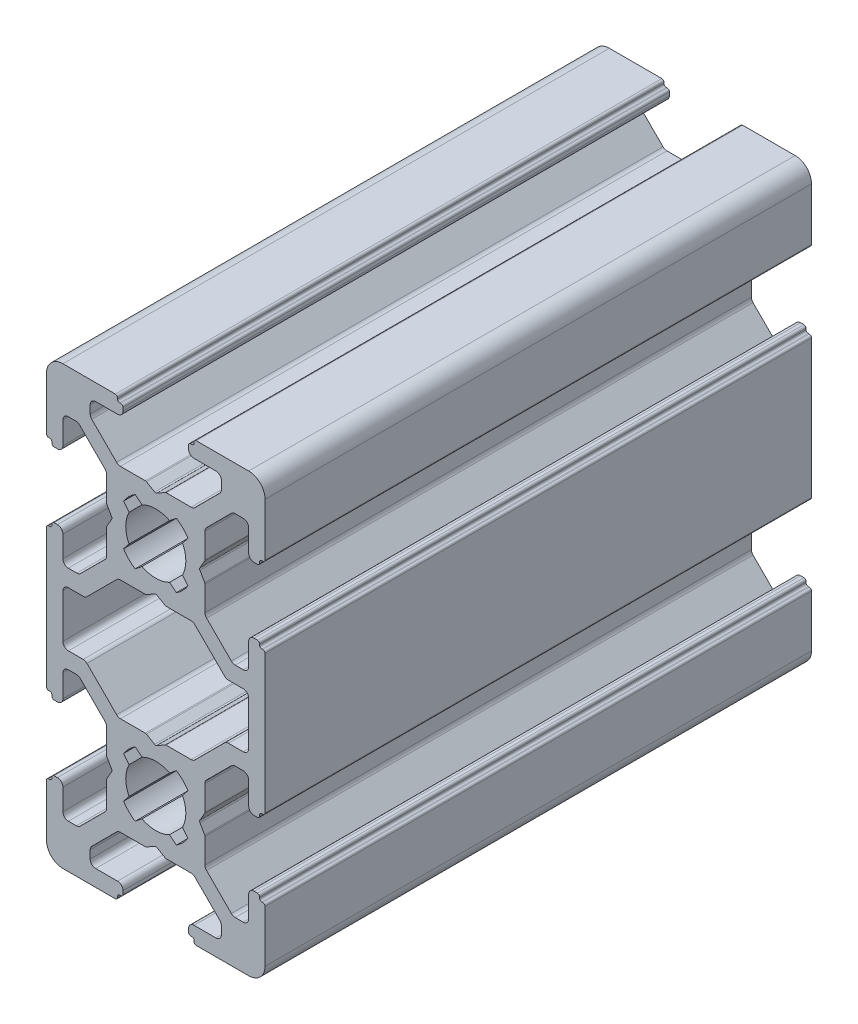
from build123d import *

# Parameters (mm, degrees)
EXTRUDE1_DEPTH = 50


with BuildPart() as part:
    # Sketch1 → Extrude1 (new body)
    with BuildSketch(Plane.XY):
        with BuildLine():
            Line((10, -3.749999824), (10, -8.500000461))
            ThreePointArc((10, -8.500000461), (9.560660307, -9.560660307), (8.500000461, -10))
            Line((8.500000461, -10), (3.699999971, -10))
            ThreePointArc((3.699999971, -10), (3.558578595, -9.941421336), (3.499999971, -9.799999942))
            Line((3.499999971, -9.799999942), (3.5, -9.699999942))
            ThreePointArc((3.5, -9.699999942), (3.441421377, -9.558578549), (3.3, -9.499999885))
            Line((3.3, -9.499999885), (3.2, -9.499999885))
            ThreePointArc((3.2, -9.499999885), (3.058578644, -9.441421241), (3, -9.299999885))
            Line((3, -9.299999885), (3, -9.000001846))
            ThreePointArc((3, -9.000001846), (3.146446609, -8.646448455), (3.5, -8.500001846))
            Line((3.5, -8.500001846), (5.499999866, -8.500001846))
            ThreePointArc((5.499999866, -8.500001846), (5.853553351, -8.353555197), (6, -8.000001712))
            Line((6, -8.000001712), (6, -7.267766328))
            ThreePointArc((6, -7.267766328), (5.961939756, -7.076424587), (5.853553353, -6.914212899))
            Line((5.853553353, -6.914212899), (3.585786596, -4.646446628))
            ThreePointArc((3.585786596, -4.646446628), (3.423574935, -4.53806028), (3.232233243, -4.500000057))
            Line((3.232233243, -4.500000057), (0.953593447, -4.500000057))
            ThreePointArc((0.953593447, -4.500000057), (0.901829637, -4.493185222), (0.853593445, -4.473205136))
            Line((0.853593445, -4.473205136), (0.100000013, -4.038117753))
            ThreePointArc((0.100000013, -4.038117753), (0, -4.011322829), (-0.100000013, -4.038117753))
            Line((-0.100000013, -4.038117753), (-0.853593445, -4.473205136))
            ThreePointArc((-0.853593445, -4.473205136), (-0.901829637, -4.493185222), (-0.953593447, -4.500000057))
            Line((-0.953593447, -4.500000057), (-3.232233243, -4.500000057))
            ThreePointArc((-3.232233243, -4.500000057), (-3.423574935, -4.53806028), (-3.585786596, -4.646446628))
            Line((-3.585786596, -4.646446628), (-5.853553353, -6.914212899))
            ThreePointArc((-5.853553353, -6.914212899), (-5.961939756, -7.076424587), (-6, -7.267766328))
            Line((-6, -7.267766328), (-6, -8.000000007))
            ThreePointArc((-6, -8.000000007), (-5.85355339, -8.353553398), (-5.499999998, -8.500000007))
            Line((-5.499999998, -8.500000007), (-3.500000002, -8.5))
            ThreePointArc((-3.500000002, -8.5), (-3.14644661, -8.646446609), (-3, -9))
            Line((-3, -9), (-3, -9.299998039))
            ThreePointArc((-3, -9.299998039), (-3.058578644, -9.441419395), (-3.2, -9.499998039))
            Line((-3.2, -9.499998039), (-3.3, -9.499998039))
            ThreePointArc((-3.3, -9.499998039), (-3.441421703, -9.558577029), (-3.5, -9.699999019))
            Line((-3.5, -9.699999019), (-3.49999951, -9.799999019))
            ThreePointArc((-3.49999951, -9.799999019), (-3.558577807, -9.94142101), (-3.69999951, -10))
            Line((-3.69999951, -10), (-8.5, -10))
            ThreePointArc((-8.5, -10), (-9.560660172, -9.560660172), (-10, -8.5))
            Line((-10, -8.5), (-10, -3.749999824))
            ThreePointArc((-10, -3.749999824), (-9.941421232, -3.608578344), (-9.799999649, -3.549999824))
            Line((-9.799999649, -3.549999824), (-9.699999649, -3.55))
            ThreePointArc((-9.699999649, -3.55), (-9.558578066, -3.49142148), (-9.499999298, -3.35))
            Line((-9.499999298, -3.35), (-9.499999298, -3.25))
            ThreePointArc((-9.499999298, -3.25), (-9.441420654, -3.108578644), (-9.299999298, -3.05))
            Line((-9.299999298, -3.05), (-8.999999788, -3.05))
            ThreePointArc((-8.999999788, -3.05), (-8.646446398, -3.196446609), (-8.499999788, -3.55))
            Line((-8.499999788, -3.55), (-8.499999788, -5.50000039))
            ThreePointArc((-8.499999788, -5.50000039), (-8.35355314, -5.853553875), (-7.999999654, -6.000000524))
            Line((-7.999999654, -6.000000524), (-7.267766643, -6.000000524))
            ThreePointArc((-7.267766643, -6.000000524), (-7.076424734, -5.96194021), (-6.914212957, -5.853553619))
            Line((-6.914212957, -5.853553619), (-4.646446283, -3.585783155))
            ThreePointArc((-4.646446283, -3.585783155), (-4.538060123, -3.423571583), (-4.499999969, -3.23223006))
            Line((-4.499999969, -3.23223006), (-4.499999969, -0.953590264))
            ThreePointArc((-4.499999969, -0.953590264), (-4.493185135, -0.901826456), (-4.473205051, -0.853590266))
            Line((-4.473205051, -0.853590266), (-4.038119483, -0.099999935))
            ThreePointArc((-4.038119483, -0.099999935), (-4.011324562, 7.7e-08), (-4.038119486, 0.100000089))
            Line((-4.038119486, 0.100000089), (-4.473205047, 0.853590344))
            ThreePointArc((-4.473205047, 0.853590344), (-4.493185134, 0.901826537), (-4.499999969, 0.953590348))
            Line((-4.499999969, 0.953590348), (-4.499999969, 3.232230144))
            ThreePointArc((-4.499999969, 3.232230144), (-4.538060128, 3.423571679), (-4.6464463, 3.585783257))
            Line((-4.6464463, 3.585783257), (-6.914212063, 5.853552589))
            ThreePointArc((-6.914212063, 5.853552589), (-7.076423834, 5.961939167), (-7.267765732, 5.999999476))
            Line((-7.267765732, 5.999999476), (-8.000000569, 5.999999476))
            ThreePointArc((-8.000000569, 5.999999476), (-8.35355396, 5.853552867), (-8.500000569, 5.499999476))
            Line((-8.500000569, 5.499999476), (-8.500000569, 3.45))
            ThreePointArc((-8.500000569, 3.45), (-8.646447179, 3.096446609), (-9.000000569, 2.95))
            Line((-9.000000569, 2.95), (-9.300000079, 2.95))
            ThreePointArc((-9.300000079, 2.95), (-9.441421491, 3.008578699), (-9.500000079, 3.150000158))
            Line((-9.500000079, 3.150000158), (-9.5, 3.250000158))
            ThreePointArc((-9.5, 3.250000158), (-9.558578588, 3.391421616), (-9.7, 3.450000315))
            Line((-9.7, 3.450000315), (-9.8, 3.450000315))
            ThreePointArc((-9.8, 3.450000315), (-9.941421356, 3.508578959), (-10, 3.650000315))
            Line((-10, 3.650000315), (-10, 9.999999757))
            Line((-10, 9.999999757), (-10, 16.3))
            ThreePointArc((-10, 16.3), (-9.941421356, 16.441421356), (-9.8, 16.5))
            Line((-9.8, 16.5), (-9.7, 16.5))
            ThreePointArc((-9.7, 16.5), (-9.558578644, 16.558578644), (-9.5, 16.7))
            Line((-9.5, 16.7), (-9.5, 16.8))
            ThreePointArc((-9.5, 16.8), (-9.441421356, 16.941421356), (-9.3, 17))
            Line((-9.3, 17), (-9.00000049, 17))
            ThreePointArc((-9.00000049, 17), (-8.6464471, 16.853553391), (-8.50000049, 16.5))
            Line((-8.50000049, 16.5), (-8.50000049, 14.55))
            ThreePointArc((-8.50000049, 14.55), (-8.353553881, 14.196446609), (-8.00000049, 14.05))
            Line((-8.00000049, 14.05), (-7.217766334, 14.05))
            ThreePointArc((-7.217766334, 14.05), (-7.026424436, 14.088060309), (-6.864212665, 14.196446888))
            Line((-6.864212665, 14.196446888), (-4.6464463, 16.414216743))
            ThreePointArc((-4.6464463, 16.414216743), (-4.538060128, 16.576428321), (-4.499999969, 16.767769856))
            Line((-4.499999969, 16.767769856), (-4.499999969, 19.046409652))
            ThreePointArc((-4.499999969, 19.046409652), (-4.493185134, 19.098173463), (-4.473205047, 19.146409656))
            Line((-4.473205047, 19.146409656), (-4.038119486, 19.899999911))
            ThreePointArc((-4.038119486, 19.899999911), (-4.011324562, 19.999999923), (-4.038119483, 20.099999935))
            Line((-4.038119483, 20.099999935), (-4.473205051, 20.853590266))
            ThreePointArc((-4.473205051, 20.853590266), (-4.493185135, 20.901826456), (-4.499999969, 20.953590264))
            Line((-4.499999969, 20.953590264), (-4.499999969, 23.23223006))
            ThreePointArc((-4.499999969, 23.23223006), (-4.538060123, 23.423571583), (-4.646446283, 23.585783155))
            Line((-4.646446283, 23.585783155), (-6.96421235, 25.903553095))
            ThreePointArc((-6.96421235, 25.903553095), (-7.126424126, 26.011939686), (-7.317766036, 26.05))
            Line((-7.317766036, 26.05), (-7.999999654, 26.05))
            ThreePointArc((-7.999999654, 26.05), (-8.35355314, 25.903553351), (-8.499999788, 25.549999866))
            Line((-8.499999788, 25.549999866), (-8.499999788, 23.5))
            ThreePointArc((-8.499999788, 23.5), (-8.646446398, 23.146446609), (-8.999999788, 23))
            Line((-8.999999788, 23), (-9.299999298, 23))
            ThreePointArc((-9.299999298, 23), (-9.441420654, 23.058578644), (-9.499999298, 23.2))
            Line((-9.499999298, 23.2), (-9.499999298, 23.3))
            ThreePointArc((-9.499999298, 23.3), (-9.558578066, 23.44142148), (-9.699999649, 23.5))
            Line((-9.699999649, 23.5), (-9.799999649, 23.499999824))
            ThreePointArc((-9.799999649, 23.499999824), (-9.941421232, 23.558578344), (-10, 23.699999824))
            Line((-10, 23.699999824), (-10, 28.5))
            ThreePointArc((-10, 28.5), (-9.560660172, 29.560660172), (-8.5, 30))
            Line((-8.5, 30), (-3.699999511, 30))
            ThreePointArc((-3.699999511, 30), (-3.55857781, 29.941421011), (-3.499999511, 29.799999023))
            Line((-3.499999511, 29.799999023), (-3.5, 29.699999023))
            ThreePointArc((-3.5, 29.699999023), (-3.441421702, 29.558577035), (-3.3, 29.499998046))
            Line((-3.3, 29.499998046), (-3.2, 29.499998046))
            ThreePointArc((-3.2, 29.499998046), (-3.058578644, 29.441419402), (-3, 29.299998046))
            Line((-3, 29.299998046), (-3, 29.000000007))
            ThreePointArc((-3, 29.000000007), (-3.146446609, 28.646446616), (-3.5, 28.500000007))
            Line((-3.5, 28.500000007), (-5.5, 28.500000007))
            ThreePointArc((-5.5, 28.500000007), (-5.853553391, 28.353553397), (-6, 28.000000007))
            Line((-6, 28.000000007), (-6, 27.267766328))
            ThreePointArc((-6, 27.267766328), (-5.961940442, 27.076426242), (-5.853555886, 26.914215433))
            Line((-5.853555886, 26.914215433), (-3.585869751, 24.646497282))
            ThreePointArc((-3.585869751, 24.646497282), (-3.423657211, 24.538109086), (-3.232313865, 24.500048177))
            Line((-3.232313865, 24.500048177), (-0.953674069, 24.500048177))
            ThreePointArc((-0.953674069, 24.500048177), (-0.901910257, 24.493233342), (-0.853674064, 24.473253255))
            Line((-0.853674064, 24.473253255), (-0.100000047, 24.038119334))
            ThreePointArc((-0.100000047, 24.038119334), (-3.5e-08, 24.011324409), (0.099999978, 24.03811933))
            Line((0.099999978, 24.03811933), (0.853674071, 24.473253259))
            ThreePointArc((0.853674071, 24.473253259), (0.901910261, 24.493233342), (0.953674069, 24.500048177))
            Line((0.953674069, 24.500048177), (3.232313865, 24.500048177))
            ThreePointArc((3.232313865, 24.500048177), (3.423657211, 24.538109086), (3.585869751, 24.646497282))
            Line((3.585869751, 24.646497282), (5.853555886, 26.914215433))
            ThreePointArc((5.853555886, 26.914215433), (5.961940442, 27.076426242), (6, 27.267766328))
            Line((6, 27.267766328), (6, 28.000001712))
            ThreePointArc((6, 28.000001712), (5.853553351, 28.353555197), (5.499999866, 28.500001846))
            Line((5.499999866, 28.500001846), (3.5, 28.500001846))
            ThreePointArc((3.5, 28.500001846), (3.146446609, 28.646448455), (3, 29.000001846))
            Line((3, 29.000001846), (3, 29.299999885))
            ThreePointArc((3, 29.299999885), (3.058578562, 29.441421159), (3.199999769, 29.499999885))
            Line((3.199999769, 29.499999885), (3.299999769, 29.5))
            ThreePointArc((3.299999769, 29.5), (3.441420976, 29.558578725), (3.499999539, 29.7))
            Line((3.499999539, 29.7), (3.499999539, 29.8))
            ThreePointArc((3.499999539, 29.8), (3.558578182, 29.941421356), (3.699999539, 30))
            Line((3.699999539, 30), (8.500000027, 30))
            ThreePointArc((8.500000027, 30), (9.56066018, 29.56066018), (10, 28.500000027))
            Line((10, 28.500000027), (10, 23.699999824))
            ThreePointArc((10, 23.699999824), (9.941421232, 23.558578344), (9.799999649, 23.499999824))
            Line((9.799999649, 23.499999824), (9.699999649, 23.5))
            ThreePointArc((9.699999649, 23.5), (9.558578066, 23.44142148), (9.499999298, 23.3))
            Line((9.499999298, 23.3), (9.499999298, 23.2))
            ThreePointArc((9.499999298, 23.2), (9.441420654, 23.058578644), (9.299999298, 23))
            Line((9.299999298, 23), (8.999999788, 23))
            ThreePointArc((8.999999788, 23), (8.646446398, 23.146446609), (8.499999788, 23.5))
            Line((8.499999788, 23.5), (8.499999788, 25.499999261))
            ThreePointArc((8.499999788, 25.499999261), (8.353553179, 25.853552652), (7.999999788, 25.999999261))
            Line((7.999999788, 25.999999261), (7.267765381, 25.999999261))
            ThreePointArc((7.267765381, 25.999999261), (7.076423471, 25.961938948), (6.914211695, 25.853552357))
            Line((6.914211695, 25.853552357), (4.646446283, 23.585783155))
            ThreePointArc((4.646446283, 23.585783155), (4.538060123, 23.423571583), (4.499999969, 23.23223006))
            Line((4.499999969, 23.23223006), (4.499999969, 20.953590264))
            ThreePointArc((4.499999969, 20.953590264), (4.493185135, 20.901826456), (4.473205051, 20.853590266))
            Line((4.473205051, 20.853590266), (4.038119525, 20.100000009))
            ThreePointArc((4.038119525, 20.100000009), (4.011324604, 20.000000005), (4.03811952, 19.899999999))
            Line((4.03811952, 19.899999999), (4.473205056, 19.146409641))
            ThreePointArc((4.473205056, 19.146409641), (4.493185136, 19.098173455), (4.499999969, 19.046409652))
            Line((4.499999969, 19.046409652), (4.499999969, 16.767769856))
            ThreePointArc((4.499999969, 16.767769856), (4.538060128, 16.576428321), (4.6464463, 16.414216743))
            Line((4.6464463, 16.414216743), (6.914213325, 14.146446149))
            ThreePointArc((6.914213325, 14.146446149), (7.076425096, 14.03805957), (7.267766994, 13.999999261))
            Line((7.267766994, 13.999999261), (7.999999654, 13.999999261))
            ThreePointArc((7.999999654, 13.999999261), (8.35355314, 14.14644591), (8.499999788, 14.499999395))
            Line((8.499999788, 14.499999395), (8.499999788, 16.5))
            ThreePointArc((8.499999788, 16.5), (8.646446398, 16.853553391), (8.999999788, 17))
            Line((8.999999788, 17), (9.299999298, 17))
            ThreePointArc((9.299999298, 17), (9.441420654, 16.941421356), (9.499999298, 16.8))
            Line((9.499999298, 16.8), (9.499999298, 16.7))
            ThreePointArc((9.499999298, 16.7), (9.558578066, 16.55857852), (9.699999649, 16.5))
            Line((9.699999649, 16.5), (9.799999649, 16.500000176))
            ThreePointArc((9.799999649, 16.500000176), (9.941421232, 16.441421656), (10, 16.300000176))
            Line((10, 16.300000176), (10, 10))
            Line((10, 10), (10, 3.650000315))
            ThreePointArc((10, 3.650000315), (9.941421356, 3.508578959), (9.8, 3.450000315))
            Line((9.8, 3.450000315), (9.7, 3.450000315))
            ThreePointArc((9.7, 3.450000315), (9.558578588, 3.391421616), (9.5, 3.250000158))
            Line((9.5, 3.250000158), (9.500000079, 3.150000158))
            ThreePointArc((9.500000079, 3.150000158), (9.441421491, 3.0085787), (9.300000079, 2.95))
            Line((9.300000079, 2.95), (9.000000569, 2.95))
            ThreePointArc((9.000000569, 2.95), (8.646447179, 3.096446609), (8.500000569, 3.45))
            Line((8.500000569, 3.45), (8.500000569, 5.499999342))
            ThreePointArc((8.500000569, 5.499999342), (8.353553921, 5.853552828), (8.000000435, 5.999999476))
            Line((8.000000435, 5.999999476), (7.267765732, 5.999999476))
            ThreePointArc((7.267765732, 5.999999476), (7.076423834, 5.961939167), (6.914212063, 5.853552589))
            Line((6.914212063, 5.853552589), (4.6464463, 3.585783257))
            ThreePointArc((4.6464463, 3.585783257), (4.538060128, 3.423571679), (4.499999969, 3.232230144))
            Line((4.499999969, 3.232230144), (4.499999969, 0.953590348))
            ThreePointArc((4.499999969, 0.953590348), (4.493185136, 0.901826545), (4.473205056, 0.853590359))
            Line((4.473205056, 0.853590359), (4.03811952, 0.100000001))
            ThreePointArc((4.03811952, 0.100000001), (4.011324604, -5e-09), (4.038119525, -0.100000009))
            Line((4.038119525, -0.100000009), (4.473205051, -0.853590266))
            ThreePointArc((4.473205051, -0.853590266), (4.493185135, -0.901826456), (4.499999969, -0.953590264))
            Line((4.499999969, -0.953590264), (4.499999969, -3.23223006))
            ThreePointArc((4.499999969, -3.23223006), (4.538060123, -3.423571583), (4.646446283, -3.585783155))
            Line((4.646446283, -3.585783155), (6.914212957, -5.853553619))
            ThreePointArc((6.914212957, -5.853553619), (7.076424734, -5.96194021), (7.267766643, -6.000000524))
            Line((7.267766643, -6.000000524), (7.999999788, -6.000000524))
            ThreePointArc((7.999999788, -6.000000524), (8.353553179, -5.853553914), (8.499999788, -5.500000524))
            Line((8.499999788, -5.500000524), (8.499999788, -3.55))
            ThreePointArc((8.499999788, -3.55), (8.646446398, -3.196446609), (8.999999788, -3.05))
            Line((8.999999788, -3.05), (9.299999298, -3.05))
            ThreePointArc((9.299999298, -3.05), (9.441420654, -3.108578644), (9.499999298, -3.25))
            Line((9.499999298, -3.25), (9.499999298, -3.35))
            ThreePointArc((9.499999298, -3.35), (9.558578066, -3.49142148), (9.699999649, -3.55))
            Line((9.699999649, -3.55), (9.799999649, -3.549999824))
            ThreePointArc((9.799999649, -3.549999824), (9.941421232, -3.608578344), (10, -3.749999824))
        make_face()
        with BuildLine():
            Line((2.445295362, 18.741814564), (2.947714945, 18.112944992))
            ThreePointArc((2.947714945, 18.112944992), (2.474873674, 17.525126206), (1.887054865, 17.052284963))
            Line((1.887054865, 17.052284963), (1.258185317, 17.554704577))
            ThreePointArc((1.258185317, 17.554704577), (-6.7e-08, 17.25), (-1.258185436, 17.554704638))
            Line((-1.258185436, 17.554704638), (-1.887055008, 17.052285055))
            ThreePointArc((-1.887055008, 17.052285055), (-2.474873794, 17.525126326), (-2.947715037, 18.112945135))
            Line((-2.947715037, 18.112945135), (-2.445295423, 18.741814683))
            ThreePointArc((-2.445295423, 18.741814683), (-2.75, 20.000000067), (-2.445295362, 21.258185436))
            Line((-2.445295362, 21.258185436), (-2.947714945, 21.887055008))
            ThreePointArc((-2.947714945, 21.887055008), (-2.474873674, 22.474873794), (-1.887054865, 22.947715037))
            Line((-1.887054865, 22.947715037), (-1.258185317, 22.445295423))
            ThreePointArc((-1.258185317, 22.445295423), (6.7e-08, 22.75), (1.258185436, 22.445295362))
            Line((1.258185436, 22.445295362), (1.887055008, 22.947714945))
            ThreePointArc((1.887055008, 22.947714945), (2.474873794, 22.474873674), (2.947715037, 21.887054865))
            Line((2.947715037, 21.887054865), (2.445295423, 21.258185317))
            ThreePointArc((2.445295423, 21.258185317), (2.75, 19.999999933), (2.445295362, 18.741814564))
        make_face(mode=Mode.SUBTRACT)
        with BuildLine():
            Line((3.232248767, 15.499989219), (0.953608971, 15.499989219))
            ThreePointArc((0.953608971, 15.499989219), (0.90184516, 15.506804055), (0.853608967, 15.526784141))
            Line((0.853608967, 15.526784141), (0.100000047, 15.961880478))
            ThreePointArc((0.100000047, 15.961880478), (3.5e-08, 15.988675403), (-0.099999978, 15.961880482))
            Line((-0.099999978, 15.961880482), (-0.853608973, 15.526784137))
            ThreePointArc((-0.853608973, 15.526784137), (-0.901845163, 15.506804054), (-0.953608971, 15.499989219))
            Line((-0.953608971, 15.499989219), (-3.232248767, 15.499989219))
            ThreePointArc((-3.232248767, 15.499989219), (-3.42359066, 15.461928912), (-3.585802428, 15.35354234))
            Line((-3.585802428, 15.35354234), (-6.292893753, 12.646446879))
            ThreePointArc((-6.292893753, 12.646446879), (-6.455105521, 12.538060307), (-6.646447414, 12.5))
            Line((-6.646447414, 12.5), (-7.999999788, 12.5))
            ThreePointArc((-7.999999788, 12.5), (-8.353553179, 12.353553391), (-8.499999788, 12))
            Line((-8.499999788, 12), (-8.499999788, 8))
            ThreePointArc((-8.499999788, 8), (-8.353553179, 7.646446609), (-7.999999788, 7.5))
            Line((-7.999999788, 7.5), (-6.646447414, 7.5))
            ThreePointArc((-6.646447414, 7.5), (-6.455102332, 7.461938372), (-6.292888871, 7.353548238))
            Line((-6.292888871, 7.353548238), (-3.585984195, 4.646564667))
            ThreePointArc((-3.585984195, 4.646564667), (-3.423770734, 4.538174533), (-3.232425652, 4.500112905))
            Line((-3.232425652, 4.500112905), (-0.953785856, 4.500112905))
            ThreePointArc((-0.953785856, 4.500112905), (-0.902022048, 4.493298071), (-0.853785858, 4.473317987))
            Line((-0.853785858, 4.473317987), (-0.099999978, 4.038119518))
            ThreePointArc((-0.099999978, 4.038119518), (3.5e-08, 4.011324597), (0.100000047, 4.038119522))
            Line((0.100000047, 4.038119522), (0.853785852, 4.473317984))
            ThreePointArc((0.853785852, 4.473317984), (0.902022045, 4.49329807), (0.953785856, 4.500112905))
            Line((0.953785856, 4.500112905), (3.232425652, 4.500112905))
            ThreePointArc((3.232425652, 4.500112905), (3.423770734, 4.538174533), (3.585984195, 4.646564667))
            Line((3.585984195, 4.646564667), (6.292888591, 7.353547959))
            ThreePointArc((6.292888591, 7.353547959), (6.455102052, 7.461938093), (6.646447134, 7.49999972))
            Line((6.646447134, 7.49999972), (7.999999788, 7.49999972))
            ThreePointArc((7.999999788, 7.49999972), (8.353553179, 7.64644633), (8.499999788, 7.99999972))
            Line((8.499999788, 7.99999972), (8.499999788, 12.000000281))
            ThreePointArc((8.499999788, 12.000000281), (8.353553179, 12.353553672), (7.999999788, 12.500000281))
            Line((7.999999788, 12.500000281), (6.646447132, 12.500000281))
            ThreePointArc((6.646447132, 12.500000281), (6.45510524, 12.538060588), (6.292893472, 12.646447161))
            Line((6.292893472, 12.646447161), (3.585802428, 15.35354234))
            ThreePointArc((3.585802428, 15.35354234), (3.42359066, 15.461928912), (3.232248767, 15.499989219))
        make_face(mode=Mode.SUBTRACT)
        with BuildLine():
            Line((1.258185436, -2.445295362), (1.887055008, -2.947714945))
            ThreePointArc((1.887055008, -2.947714945), (2.474873794, -2.474873674), (2.947715037, -1.887054865))
            Line((2.947715037, -1.887054865), (2.445295423, -1.258185317))
            ThreePointArc((2.445295423, -1.258185317), (2.75, 6.7e-08), (2.445295362, 1.258185436))
            Line((2.445295362, 1.258185436), (2.947714945, 1.887055008))
            ThreePointArc((2.947714945, 1.887055008), (2.474873674, 2.474873794), (1.887054865, 2.947715037))
            Line((1.887054865, 2.947715037), (1.258185317, 2.445295423))
            ThreePointArc((1.258185317, 2.445295423), (-6.7e-08, 2.75), (-1.258185436, 2.445295362))
            Line((-1.258185436, 2.445295362), (-1.887055008, 2.947714945))
            ThreePointArc((-1.887055008, 2.947714945), (-2.474873794, 2.474873674), (-2.947715037, 1.887054865))
            Line((-2.947715037, 1.887054865), (-2.445295423, 1.258185317))
            ThreePointArc((-2.445295423, 1.258185317), (-2.75, -6.7e-08), (-2.445295362, -1.258185436))
            Line((-2.445295362, -1.258185436), (-2.947714945, -1.887055008))
            ThreePointArc((-2.947714945, -1.887055008), (-2.474873674, -2.474873794), (-1.887054865, -2.947715037))
            Line((-1.887054865, -2.947715037), (-1.258185317, -2.445295423))
            ThreePointArc((-1.258185317, -2.445295423), (6.7e-08, -2.75), (1.258185436, -2.445295362))
        make_face(mode=Mode.SUBTRACT)
    extrude(amount=EXTRUDE1_DEPTH)


solid = part.part
